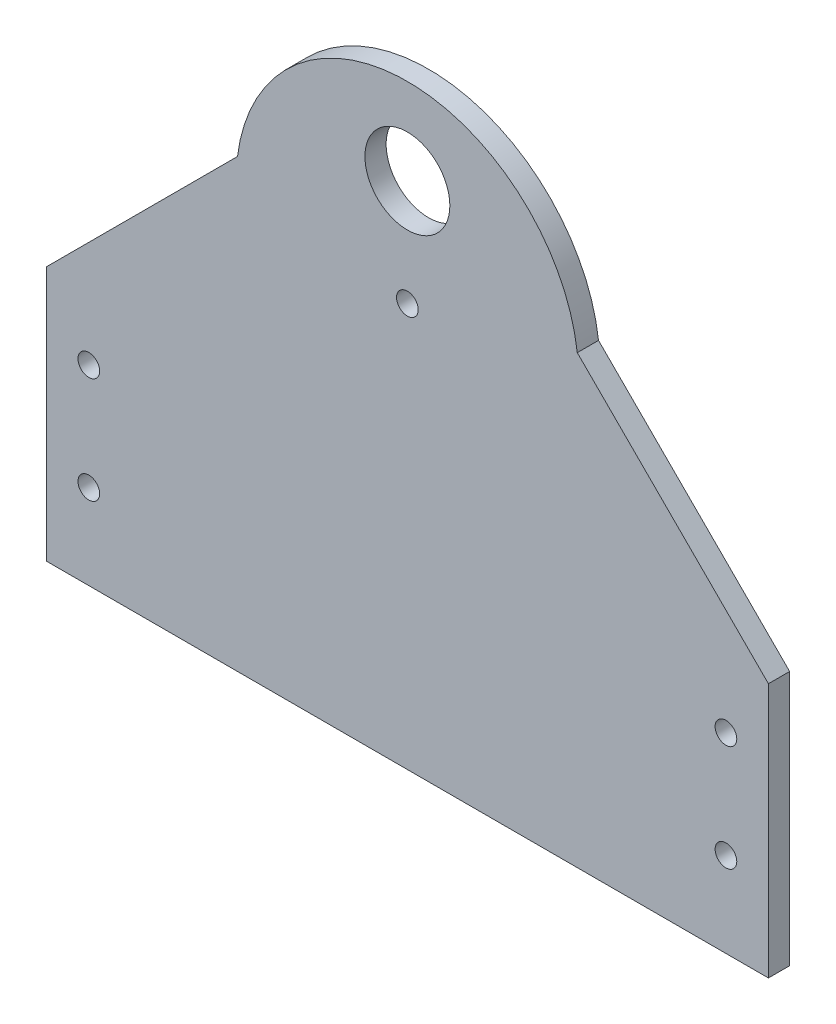
from build123d import *

# Parameters (mm, degrees)
SKETCH_1_R      = 2.55
SKETCH_1_R_2    = 10
EXTRUDE_1_DEPTH = 5


with BuildPart() as part:
    # ｽｹｯﾁ1 → ﾎﾞｽ - 押し出し1 (new body)
    with BuildSketch(Plane.XY):
        with BuildLine():
            Line((-85, -71.4), (-85, -11.4))
            Line((-85, -11.4), (-40, 33.6))
            ThreePointArc((-40, 33.6), (0, 68.911288741), (40, 33.6))
            Line((40, 33.6), (85, -11.4))
            Line((85, -11.4), (85, -71.4))
            Line((85, -71.4), (-85, -71.4))
        make_face()
        with Locations((75, -26.4)):
            Circle(SKETCH_1_R, mode=Mode.SUBTRACT)
        with Locations((75, -51.4)):
            Circle(SKETCH_1_R, mode=Mode.SUBTRACT)
        with Locations((-75, -26.4)):
            Circle(SKETCH_1_R, mode=Mode.SUBTRACT)
        with Locations((-75, -51.4)):
            Circle(SKETCH_1_R, mode=Mode.SUBTRACT)
        with Locations((0, 23.6)):
            Circle(SKETCH_1_R, mode=Mode.SUBTRACT)
        with Locations((0, 48.6)):
            Circle(SKETCH_1_R_2, mode=Mode.SUBTRACT)
    extrude(amount=EXTRUDE_1_DEPTH)


solid = part.part
